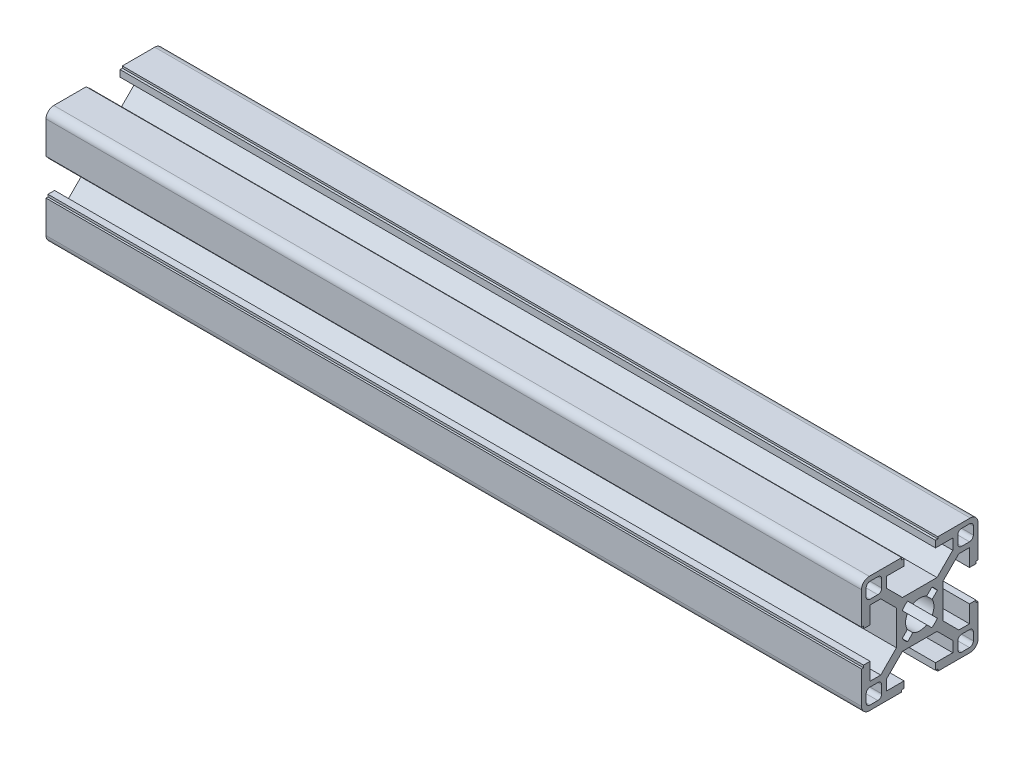
from build123d import *

# Parameters (mm, degrees)
AUFSATZ_LINEAR_AUSTRAGEN1_DEPTH = 280
SCALE1_SCALE_X                  = 1
SCALE1_SCALE_Y                  = 1.333333333
SCALE1_SCALE_Z                  = 1.333333333


with BuildPart() as part:
    # Skizze1 → Aufsatz-Linear austragen1 (new body)
    with BuildSketch(Plane(origin=(0, 0, 0), x_dir=(0, 0, -1), z_dir=(1, 0, 0))):
        with BuildLine():
            Line((10.055634919, 8.5), (12.8, 8.5))
            Line((12.8, 8.5), (12.8, 4.05))
            Line((12.8, 4.05), (14.5, 4.05))
            Line((14.5, 4.05), (14.5, 4.651637069))
            Line((14.5, 4.651637069), (15, 4.651637069))
            Line((15, 4.651637069), (15, 13))
            ThreePointArc((15, 13), (14.414213562, 14.414213562), (13, 15))
            Line((13, 15), (4.651637069, 15))
            Line((4.651637069, 15), (4.651637069, 14.5))
            Line((4.651637069, 14.5), (4.05, 14.5))
            Line((4.05, 14.5), (4.05, 12.8))
            Line((4.05, 12.8), (8.5, 12.8))
            Line((8.5, 12.8), (8.5, 10.055634919))
            Line((8.5, 10.055634919), (4.444365081, 6))
            Line((4.444365081, 6), (-4.444365081, 6))
            Line((-4.444365081, 6), (-8.5, 10.055634919))
            Line((-8.5, 10.055634919), (-8.5, 12.8))
            Line((-8.5, 12.8), (-4.05, 12.8))
            Line((-4.05, 12.8), (-4.05, 14.5))
            Line((-4.05, 14.5), (-4.651637069, 14.5))
            Line((-4.651637069, 14.5), (-4.651637069, 15))
            Line((-4.651637069, 15), (-13, 15))
            ThreePointArc((-13, 15), (-14.414213562, 14.414213562), (-15, 13))
            Line((-15, 13), (-15, 4.651637069))
            Line((-15, 4.651637069), (-14.5, 4.651637069))
            Line((-14.5, 4.651637069), (-14.5, 4.05))
            Line((-14.5, 4.05), (-12.8, 4.05))
            Line((-12.8, 4.05), (-12.8, 8.5))
            Line((-12.8, 8.5), (-10.055634919, 8.5))
            Line((-10.055634919, 8.5), (-6, 4.444365081))
            Line((-6, 4.444365081), (-6, -4.444365081))
            Line((-6, -4.444365081), (-10.055634919, -8.5))
            Line((-10.055634919, -8.5), (-12.8, -8.5))
            Line((-12.8, -8.5), (-12.8, -4.05))
            Line((-12.8, -4.05), (-14.5, -4.05))
            Line((-14.5, -4.05), (-14.5, -4.651637069))
            Line((-14.5, -4.651637069), (-15, -4.651637069))
            Line((-15, -4.651637069), (-15, -13))
            ThreePointArc((-15, -13), (-14.414213562, -14.414213562), (-13, -15))
            Line((-13, -15), (-4.651637069, -15))
            Line((-4.651637069, -15), (-4.651637069, -14.5))
            Line((-4.651637069, -14.5), (-4.05, -14.5))
            Line((-4.05, -14.5), (-4.05, -12.8))
            Line((-4.05, -12.8), (-8.5, -12.8))
            Line((-8.5, -12.8), (-8.5, -10.055634919))
            Line((-8.5, -10.055634919), (-4.444365081, -6))
            Line((-4.444365081, -6), (4.444365081, -6))
            Line((4.444365081, -6), (8.5, -10.055634919))
            Line((8.5, -10.055634919), (8.5, -12.8))
            Line((8.5, -12.8), (4.05, -12.8))
            Line((4.05, -12.8), (4.05, -14.5))
            Line((4.05, -14.5), (4.651637069, -14.5))
            Line((4.651637069, -14.5), (4.651637069, -15))
            Line((4.651637069, -15), (13, -15))
            ThreePointArc((13, -15), (14.414213562, -14.414213562), (15, -13))
            Line((15, -13), (15, -4.651637069))
            Line((15, -4.651637069), (14.5, -4.651637069))
            Line((14.5, -4.651637069), (14.5, -4.05))
            Line((14.5, -4.05), (12.8, -4.05))
            Line((12.8, -4.05), (12.8, -8.5))
            Line((12.8, -8.5), (10.055634919, -8.5))
            Line((10.055634919, -8.5), (6, -4.444365081))
            Line((6, -4.444365081), (6, 4.444365081))
            Line((6, 4.444365081), (10.055634919, 8.5))
        make_face()
        with BuildLine():
            ThreePointArc((12.8, 13.8), (13.507106781, 13.507106781), (13.8, 12.8))
            Line((13.8, 12.8), (13.8, 10.8))
            ThreePointArc((13.8, 10.8), (13.507106781, 10.092893219), (12.8, 9.8))
            Line((12.8, 9.8), (10.8, 9.8))
            ThreePointArc((10.8, 9.8), (10.092893219, 10.092893219), (9.8, 10.8))
            Line((9.8, 10.8), (9.8, 12.8))
            ThreePointArc((9.8, 12.8), (10.092893219, 13.507106781), (10.8, 13.8))
            Line((10.8, 13.8), (12.8, 13.8))
        make_face(mode=Mode.SUBTRACT)
        with BuildLine():
            Line((-3.117157854, 4.531371416), (-1.775079755, 3.189293317))
            ThreePointArc((-1.775079755, 3.189293317), (0, 3.65), (1.775079755, 3.189293317))
            Line((1.775079755, 3.189293317), (3.117157854, 4.531371416))
            ThreePointArc((3.117157854, 4.531371416), (3.889087297, 3.889087297), (4.531371416, 3.117157854))
            Line((4.531371416, 3.117157854), (3.189293317, 1.775079755))
            ThreePointArc((3.189293317, 1.775079755), (3.65, 0), (3.189293317, -1.775079755))
            Line((3.189293317, -1.775079755), (4.531371416, -3.117157854))
            ThreePointArc((4.531371416, -3.117157854), (3.889087297, -3.889087297), (3.117157854, -4.531371416))
            Line((3.117157854, -4.531371416), (1.775079755, -3.189293317))
            ThreePointArc((1.775079755, -3.189293317), (0, -3.65), (-1.775079755, -3.189293317))
            Line((-1.775079755, -3.189293317), (-3.117157854, -4.531371416))
            ThreePointArc((-3.117157854, -4.531371416), (-3.889087297, -3.889087297), (-4.531371416, -3.117157854))
            Line((-4.531371416, -3.117157854), (-3.189293317, -1.775079755))
            ThreePointArc((-3.189293317, -1.775079755), (-3.65, 0), (-3.189293317, 1.775079755))
            Line((-3.189293317, 1.775079755), (-4.531371416, 3.117157854))
            ThreePointArc((-4.531371416, 3.117157854), (-3.889087297, 3.889087297), (-3.117157854, 4.531371416))
        make_face(mode=Mode.SUBTRACT)
        with BuildLine():
            ThreePointArc((-13.8, 12.8), (-13.507106781, 13.507106781), (-12.8, 13.8))
            Line((-12.8, 13.8), (-10.8, 13.8))
            ThreePointArc((-10.8, 13.8), (-10.092893219, 13.507106781), (-9.8, 12.8))
            Line((-9.8, 12.8), (-9.8, 10.8))
            ThreePointArc((-9.8, 10.8), (-10.092893219, 10.092893219), (-10.8, 9.8))
            Line((-10.8, 9.8), (-12.8, 9.8))
            ThreePointArc((-12.8, 9.8), (-13.507106781, 10.092893219), (-13.8, 10.8))
            Line((-13.8, 10.8), (-13.8, 12.8))
        make_face(mode=Mode.SUBTRACT)
        with BuildLine():
            ThreePointArc((9.8, -10.8), (10.092893219, -10.092893219), (10.8, -9.8))
            Line((10.8, -9.8), (12.8, -9.8))
            ThreePointArc((12.8, -9.8), (13.507106781, -10.092893219), (13.8, -10.8))
            Line((13.8, -10.8), (13.8, -12.8))
            ThreePointArc((13.8, -12.8), (13.507106781, -13.507106781), (12.8, -13.8))
            Line((12.8, -13.8), (10.8, -13.8))
            ThreePointArc((10.8, -13.8), (10.092893219, -13.507106781), (9.8, -12.8))
            Line((9.8, -12.8), (9.8, -10.8))
        make_face(mode=Mode.SUBTRACT)
        with BuildLine():
            Line((-9.8, -10.8), (-9.8, -12.8))
            ThreePointArc((-9.8, -12.8), (-10.092893219, -13.507106781), (-10.8, -13.8))
            Line((-10.8, -13.8), (-12.8, -13.8))
            ThreePointArc((-12.8, -13.8), (-13.507106781, -13.507106781), (-13.8, -12.8))
            Line((-13.8, -12.8), (-13.8, -10.8))
            ThreePointArc((-13.8, -10.8), (-13.507106781, -10.092893219), (-12.8, -9.8))
            Line((-12.8, -9.8), (-10.8, -9.8))
            ThreePointArc((-10.8, -9.8), (-10.092893219, -10.092893219), (-9.8, -10.8))
        make_face(mode=Mode.SUBTRACT)
    extrude(amount=AUFSATZ_LINEAR_AUSTRAGEN1_DEPTH)


with BuildPart() as part_1:
    # Scale1: scaled about (140, 0, 0)
    add(part.part.scale((SCALE1_SCALE_X, SCALE1_SCALE_Y, SCALE1_SCALE_Z), about=(140, 0, 0)))


solid = part_1.part
